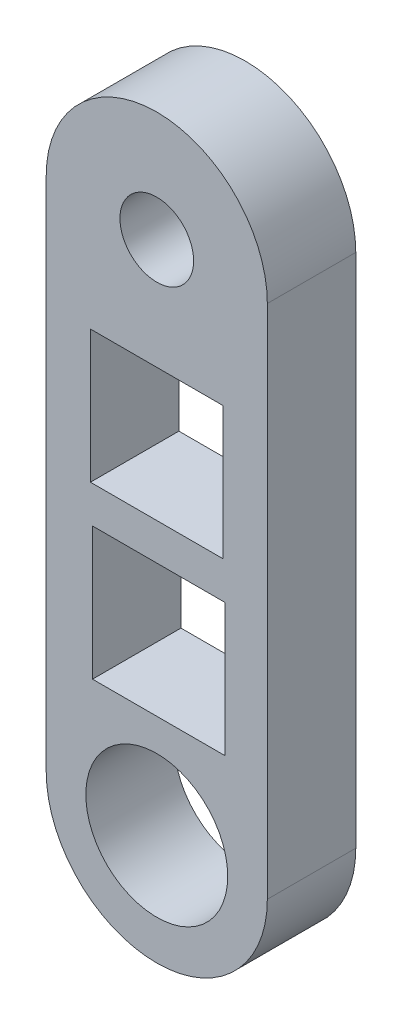
from build123d import *

# Parameters (mm, degrees)
SKETCH1_R           = 9.625
SKETCH1_R_2         = 5
SKETCH1_W           = 18
SKETCH1_H           = 18
BOSS_EXTRUDE1_DEPTH = 12


with BuildPart() as part:
    # Sketch1 → Boss-Extrude1 (new body)
    with BuildSketch(Plane.XY):
        with BuildLine():
            Line((15, 45), (15, -25))
            ThreePointArc((15, -25), (0, -40), (-15, -25))
            Line((-15, -25), (-15, 45))
            ThreePointArc((-15, 45), (0, 60), (15, 45))
        make_face()
        with Locations((0, -25)):
            Circle(SKETCH1_R, mode=Mode.SUBTRACT)
        with Locations((0, 45)):
            Circle(SKETCH1_R_2, mode=Mode.SUBTRACT)
        with Locations((0, 21)):
            Rectangle(SKETCH1_W, SKETCH1_H, mode=Mode.SUBTRACT)
        with Locations((0.28234497, -2)):
            Rectangle(SKETCH1_W, SKETCH1_H, mode=Mode.SUBTRACT)
    extrude(amount=BOSS_EXTRUDE1_DEPTH)


solid = part.part
